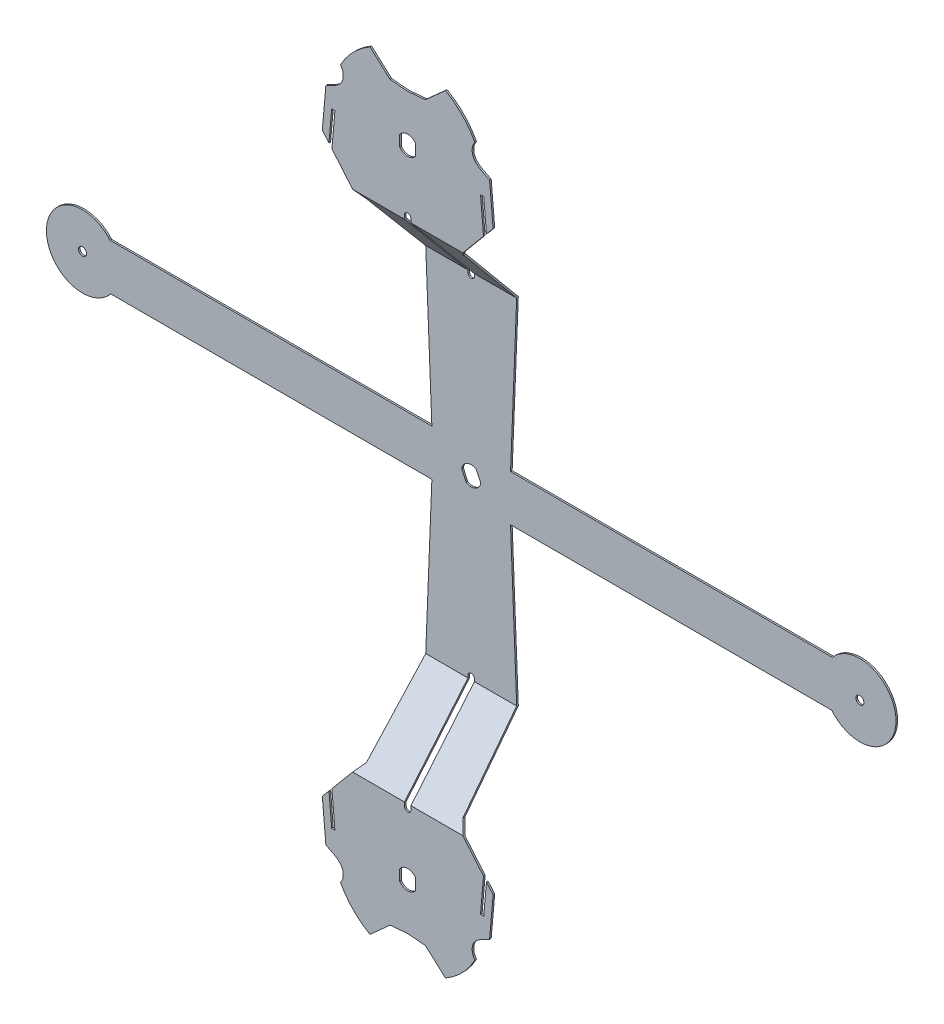
from build123d import *

# Parameters (mm, degrees)
SALIENTE_EXTRUIR1_DEPTH     = 271
CORTAR_EXTRUIR9_DEPTH       = 372.904084134
CORTAR_EXTRUIR9_DEPTH_BACK  = 372.904084134
CROQUIS4_R                  = 2.5
CORTAR_EXTRUIR11_DEPTH      = 372.904084134
CORTAR_EXTRUIR11_DEPTH_BACK = 372.904084134
CROQUIS2_W                  = 600.899293422
CROQUIS2_H                  = 554.061756016


with BuildPart() as part:
    # Croquis1 → Saliente-Extruir1 (new, symmetric)
    with BuildSketch(Plane(origin=(0, 0, 0), x_dir=(0, 0, -1), z_dir=(1, 0, 0))):
        Polygon((-18.5, -110), (-18.5, 110), (-58.031437996, 157.111733252), (-58.031437996, 248), (-57.031437996, 248), (-57.031437996, 157.475703486), (-17.5, 110.363970234), (-17.5, -110.363970234), (-57.031437996, -157.475703486), (-57.031437996, -248), (-58.031437996, -248), (-58.031437996, -157.111733252), align=None)
    extrude(amount=SALIENTE_EXTRUIR1_DEPTH, both=True)

    # Croquis4 → Cortar-Extruir9 (cut, two sides: drawn at the far end of the back side and taken through both)
    with BuildSketch(Plane.XY.offset(-CORTAR_EXTRUIR9_DEPTH_BACK)):
        with Locations(Location((-242, 0, 0), (0, 0, 90))):
            Circle(CROQUIS4_R)
        with Locations(Location((242, 0, 0), (0, 0, 90))):
            Circle(CROQUIS4_R)
        with BuildLine():
            Line((-5, 201.31662479), (-5, 194.68337521))
            ThreePointArc((-5, 194.68337521), (0, 192), (5, 194.68337521))
            Line((5, 194.68337521), (5, 201.31662479))
            ThreePointArc((5, 201.31662479), (0, 204), (-5, 201.31662479))
        make_face()
        with BuildLine():
            Line((5, -201.31662479), (5, -194.68337521))
            ThreePointArc((5, -194.68337521), (0, -192), (-5, -194.68337521))
            Line((-5, -194.68337521), (-5, -201.31662479))
            ThreePointArc((-5, -201.31662479), (0, -204), (5, -201.31662479))
        make_face()
        with BuildLine():
            Line((-5.933205139, 0.892791565), (-3.129872731, -5.118974183))
            ThreePointArc((-3.129872731, -5.118974183), (2.53570957, -5.437846722), (5.933205139, -0.892791565))
            Line((5.933205139, -0.892791565), (3.129872731, 5.118974183))
            ThreePointArc((3.129872731, 5.118974183), (-2.53570957, 5.437846722), (-5.933205139, 0.892791565))
        make_face()
    extrude(amount=CORTAR_EXTRUIR9_DEPTH + CORTAR_EXTRUIR9_DEPTH_BACK, mode=Mode.SUBTRACT)

    # Croquis2 → Cortar-Extruir11 (cut, two sides: drawn at the far end of the back side and taken through both)
    # profile 1 of 3: a face of its own
    with BuildSketch(Plane.XY.offset(-CORTAR_EXTRUIR11_DEPTH_BACK)):
        Rectangle(CROQUIS2_W, CROQUIS2_H)
        with BuildLine():
            Line((-30, 152), (-24.5, 14.560219779))
            Line((-24.5, 14.560219779), (-224.846283202, 14.560219779))
            ThreePointArc((-224.846283202, 14.560219779), (-264.498385451, -0.269540515), (-224.502381114, -14.145081595))
            Line((-224.502381114, -14.145081595), (-24.5, -14.145081595))
            Line((-24.5, -14.145081595), (-24.5, -14.560219779))
            Line((-24.5, -14.560219779), (-30, -152))
            Line((-30, -152), (-47.204993262, -172.50411253))
            Line((-47.204993262, -172.50411253), (-45.323986996, -194.00411253))
            Line((-45.323986996, -194.00411253), (-47.331626671, -194.00411253))
            Line((-47.331626671, -194.00411253), (-49.023071172, -174.670813412))
            Line((-49.023071172, -174.670813412), (-53.168424061, -179.61105261))
            Line((-53.168424061, -179.61105261), (-50.970090866, -204.738116011))
            add(Edge.make_bspline(
                [(-50.970090866, -204.738116011), (-47.792962615, -206.268732201), (-40.787060156, -209.02456014), (-39.883059345, -216.418425991), (-40.736802152, -219.176084752), (-41.896759663, -220.381052918)],
                knots=[0, 0, 0, 0, 0.610720728, 0.773572895, 1, 1, 1, 1], degree=3))
            ThreePointArc((-41.896759663, -220.381052918), (-34.036336447, -231.13273006), (-23.5, -239.279534881))
            Line((-23.5, -239.279534881), (-11, -228.04191018))
            Line((-11, -228.04191018), (0, -227.079534881))
            Line((0, -227.079534881), (11, -228.04191018))
            Line((11, -228.04191018), (23.5, -239.279534881))
            ThreePointArc((23.5, -239.279534881), (34.036336447, -231.13273006), (41.896759663, -220.381052918))
            add(Edge.make_bspline(
                [(50.970090866, -204.738116011), (47.792962615, -206.268732201), (40.787060156, -209.02456014), (39.883059345, -216.418425991), (40.736802152, -219.176084752), (41.896759663, -220.381052918)],
                knots=[0, 0, 0, 0, 0.610720728, 0.773572895, 1, 1, 1, 1], degree=3))
            Line((50.970090866, -204.738116011), (53.168424061, -179.61105261))
            Line((53.168424061, -179.61105261), (49.023071172, -174.670813412))
            Line((49.023071172, -174.670813412), (47.331626671, -194.00411253))
            Line((47.331626671, -194.00411253), (45.323986996, -194.00411253))
            Line((45.323986996, -194.00411253), (47.204993262, -172.50411253))
            Line((47.204993262, -172.50411253), (30, -152))
            Line((30, -152), (24.5, -14.560219779))
            Line((24.5, -14.560219779), (24.5, -14.145081595))
            Line((24.5, -14.145081595), (224.502381114, -14.145081595))
            ThreePointArc((224.502381114, -14.145081595), (264.498385451, -0.269540515), (224.846283202, 14.560219779))
            Line((224.846283202, 14.560219779), (24.5, 14.560219779))
            Line((24.5, 14.560219779), (30, 152))
            Line((30, 152), (47.204993262, 172.50411253))
            Line((47.204993262, 172.50411253), (45.323986996, 194.00411253))
            Line((45.323986996, 194.00411253), (47.331626671, 194.00411253))
            Line((47.331626671, 194.00411253), (49.023071172, 174.670813412))
            Line((49.023071172, 174.670813412), (53.168424061, 179.61105261))
            Line((53.168424061, 179.61105261), (50.970090866, 204.738116011))
            add(Edge.make_bspline(
                [(50.970090866, 204.738116011), (47.792962615, 206.268732201), (40.787060156, 209.02456014), (39.883059345, 216.418425991), (40.736802152, 219.176084752), (41.896759663, 220.381052918)],
                knots=[0, 0, 0, 0, 0.610720728, 0.773572895, 1, 1, 1, 1], degree=3))
            ThreePointArc((41.896759663, 220.381052918), (34.036336447, 231.13273006), (23.5, 239.279534881))
            Line((23.5, 239.279534881), (11, 228.04191018))
            Line((11, 228.04191018), (0, 227.079534881))
            Line((0, 227.079534881), (-11, 228.04191018))
            Line((-11, 228.04191018), (-23.5, 239.279534881))
            ThreePointArc((-23.5, 239.279534881), (-34.036336447, 231.13273006), (-41.896759663, 220.381052918))
            add(Edge.make_bspline(
                [(-50.970090866, 204.738116011), (-47.792962615, 206.268732201), (-40.787060156, 209.02456014), (-39.883059345, 216.418425991), (-40.736802152, 219.176084752), (-41.896759663, 220.381052918)],
                knots=[0, 0, 0, 0, 0.610720728, 0.773572895, 1, 1, 1, 1], degree=3))
            Line((-50.970090866, 204.738116011), (-53.168424061, 179.61105261))
            Line((-53.168424061, 179.61105261), (-49.023071172, 174.670813412))
            Line((-49.023071172, 174.670813412), (-47.331626671, 194.00411253))
            Line((-47.331626671, 194.00411253), (-45.323986996, 194.00411253))
            Line((-45.323986996, 194.00411253), (-47.204993262, 172.50411253))
            Line((-47.204993262, 172.50411253), (-30, 152))
        make_face(mode=Mode.SUBTRACT)
    # profile 2 of 3: a face of its own
    with BuildSketch(Plane.XY.offset(-CORTAR_EXTRUIR11_DEPTH_BACK)):
        with BuildLine():
            Line((-2, -108.5), (-2, -159.5))
            ThreePointArc((-2, -159.5), (0, -161.5), (2, -159.5))
            Line((2, -159.5), (2, -108.5))
            ThreePointArc((2, -108.5), (0, -106.5), (-2, -108.5))
        make_face()
    # profile 3 of 3: a face of its own
    with BuildSketch(Plane.XY.offset(-CORTAR_EXTRUIR11_DEPTH_BACK)):
        with BuildLine():
            Line((-2, 108.5), (-2, 159.5))
            ThreePointArc((-2, 159.5), (0, 161.5), (2, 159.5))
            Line((2, 159.5), (2, 108.5))
            ThreePointArc((2, 108.5), (0, 106.5), (-2, 108.5))
        make_face()
    extrude(amount=CORTAR_EXTRUIR11_DEPTH + CORTAR_EXTRUIR11_DEPTH_BACK, mode=Mode.SUBTRACT)


solid = part.part
